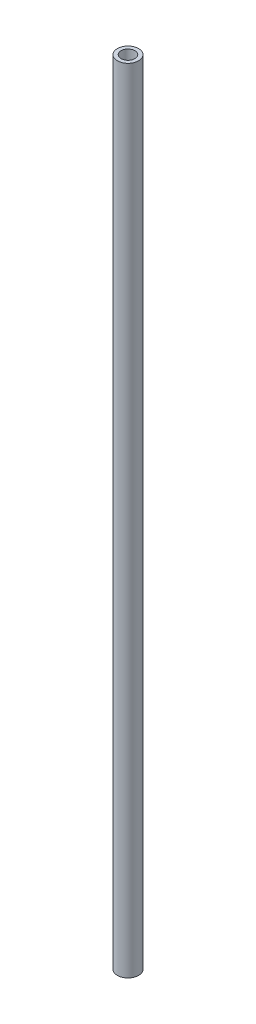
from build123d import *

# Parameters (mm, degrees)
SKETCH1_R           = 3.35
BOSS_EXTRUDE1_DEPTH = 250
SKETCH2_R           = 2.184011469
CUT_EXTRUDE1_DEPTH  = 251.04488597


with BuildPart() as part:
    # Sketch1 → Boss-Extrude1 (new body)
    with BuildSketch(Plane(origin=(0, 0, 0), x_dir=(1, 0, 0), z_dir=(0, 1, 0))):
        with Locations(Location((0, 0, 0), (0, 0, 270))):
            Circle(SKETCH1_R)
    extrude(amount=BOSS_EXTRUDE1_DEPTH)

    # Sketch2 → Cut-Extrude1 (cut, through all)
    with BuildSketch(Plane(origin=(0, 250, 0), x_dir=(1, 0, 0), z_dir=(0, 1, 0))):
        with Locations(Location((0, 0, 0), (0, 0, 270))):
            Circle(SKETCH2_R)
    extrude(amount=-CUT_EXTRUDE1_DEPTH, mode=Mode.SUBTRACT)


solid = part.part
